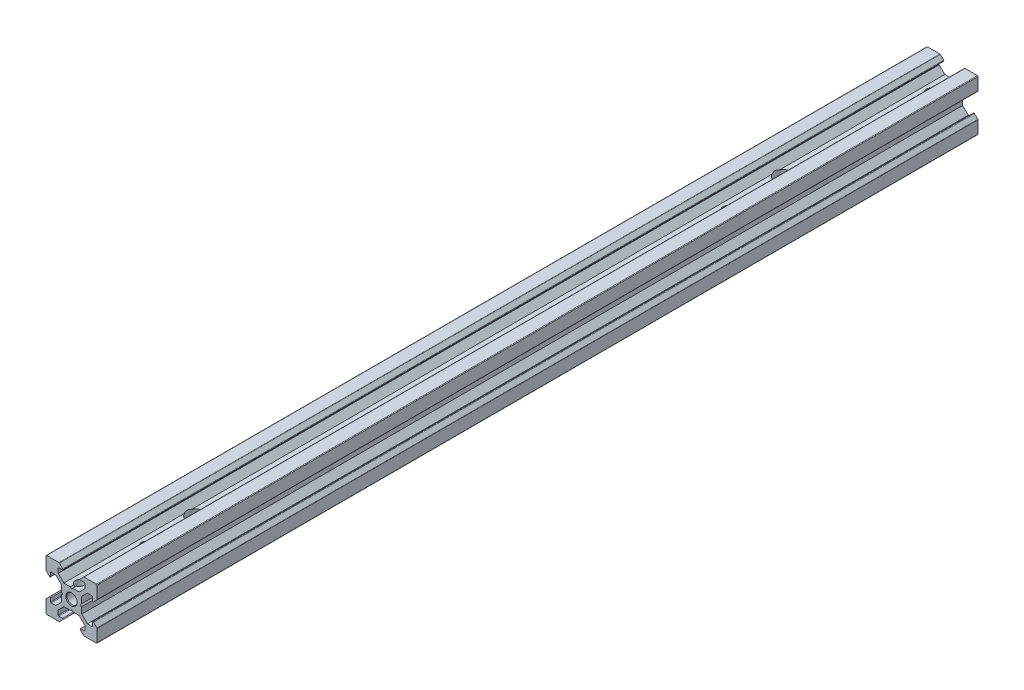
from build123d import *

# Parameters (mm, degrees)
SALIENTE_EXTRUIR1_DEPTH                              = 172.5
SALIENTE_EXTRUIR1_DEPTH_BACK                         = 172.5
CROQUIS7_R                                           = 2
CORTAR_EXTRUIR1_DEPTH                                = 346.290048435
CHAFL_N1_SIZE                                        = 0.25
DI_METRO_DE_TALADRO_3_3_3_3_1_REACH                  = 175.944
DI_METRO_DE_TALADRO_3_3_3_3_1_BORE_R                 = 1.65
REFRENTADO_PARA_TORNILLO_CON_CABEZA_PLAN_D           = 6.6
REFRENTADO_PARA_TORNILLO_CON_CABEZA_PLAN_CBORE_D     = 11
REFRENTADO_PARA_TORNILLO_CON_CABEZA_PLAN_CBORE_DEPTH = 3.9


with BuildPart() as part:
    # Croquis1 → Saliente-Extruir1 (new, two sides: drawn at the far end of the back side and taken through both)
    with BuildSketch(Plane.XY.offset(-SALIENTE_EXTRUIR1_DEPTH_BACK)):
        with BuildLine():
            Line((-3.987829457, 0.499361283), (-3.487829457, -0.000638717))
            Line((-3.487829457, -0.000638717), (-3.987559517, -0.500368777))
            Line((-3.987559517, -0.500368777), (-3.987559517, -3.008827233))
            Line((-3.987559517, -3.008827233), (-6.187829457, -5.209097173))
            Line((-6.187829457, -5.209097173), (-7.930785329, -5.209097173))
            ThreePointArc((-7.930785329, -5.209097173), (-8.107562024, -5.135873868), (-8.180785329, -4.959097173))
            Line((-8.180785329, -4.959097173), (-8.180785329, -3.614398294))
            ThreePointArc((-8.180785329, -3.614398294), (-8.335114237, -3.383428508), (-8.607561665, -3.43762124))
            Line((-8.607561665, -3.43762124), (-9.913674799, -4.743729068))
            ThreePointArc((-9.913674799, -4.743729068), (-9.967868248, -4.824835029), (-9.986898462, -4.920506122))
            Line((-9.986898462, -4.920506122), (-9.986898462, -9.749046667))
            ThreePointArc((-9.986898462, -9.749046667), (-9.913675158, -9.925823362), (-9.736898462, -9.999046667))
            Line((-9.736898462, -9.999046667), (-4.889520858, -9.999046667))
            ThreePointArc((-4.889520858, -9.999046667), (-4.79385, -9.98001655), (-4.712744163, -9.925823362))
            Line((-4.712744163, -9.925823362), (-3.412744163, -8.625823362))
            ThreePointArc((-3.412744163, -8.625823362), (-3.358550975, -8.353375809), (-3.589520858, -8.199046667))
            Line((-3.589520858, -8.199046667), (-4.947879963, -8.199046667))
            ThreePointArc((-4.947879963, -8.199046667), (-5.124656659, -8.125823362), (-5.197879963, -7.949046667))
            Line((-5.197879963, -7.949046667), (-5.197879963, -6.302600057))
            ThreePointArc((-5.197879963, -6.302600057), (-5.178849847, -6.206929199), (-5.124656659, -6.125823362))
            Line((-5.124656659, -6.125823362), (-2.998810958, -3.999977662))
            Line((-2.998810958, -3.999977662), (-0.486898462, -3.999977662))
            Line((-0.486898462, -3.999977662), (0.013101538, -3.499977662))
            Line((0.013101538, -3.499977662), (0.512831598, -3.999707722))
            Line((0.512831598, -3.999707722), (3.021290054, -3.999707722))
            Line((3.021290054, -3.999707722), (5.221559994, -6.199977662))
            Line((5.221559994, -6.199977662), (5.221559994, -7.942933534))
            ThreePointArc((5.221559994, -7.942933534), (5.148336689, -8.119710229), (4.971559994, -8.192933534))
            Line((4.971559994, -8.192933534), (3.626861115, -8.192933534))
            ThreePointArc((3.626861115, -8.192933534), (3.395891329, -8.347262441), (3.450084061, -8.61970987))
            Line((3.450084061, -8.61970987), (4.756191889, -9.925823003))
            ThreePointArc((4.756191889, -9.925823003), (4.83729785, -9.980016453), (4.932968943, -9.999046667))
            Line((4.932968943, -9.999046667), (9.761509488, -9.999046667))
            ThreePointArc((9.761509488, -9.999046667), (9.938286183, -9.925823362), (10.011509488, -9.749046667))
            Line((10.011509488, -9.749046667), (10.011509488, -4.901669063))
            ThreePointArc((10.011509488, -4.901669063), (9.992479371, -4.805998205), (9.938286183, -4.724892367))
            Line((9.938286183, -4.724892367), (8.638286183, -3.424892367))
            ThreePointArc((8.638286183, -3.424892367), (8.36583863, -3.370699179), (8.211509488, -3.601669063))
            Line((8.211509488, -3.601669063), (8.211509488, -4.960028168))
            ThreePointArc((8.211509488, -4.960028168), (8.138286183, -5.136804863), (7.961509488, -5.210028168))
            Line((7.961509488, -5.210028168), (6.211509488, -5.210028168))
            Line((6.211509488, -5.210028168), (4.012440483, -3.010959163))
            Line((4.012440483, -3.010959163), (4.012440483, -0.499046667))
            Line((4.012440483, -0.499046667), (3.512440483, 0.000953333))
            Line((3.512440483, 0.000953333), (4.012170543, 0.500683393))
            Line((4.012170543, 0.500683393), (4.012170543, 3.00914185))
            Line((4.012170543, 3.00914185), (6.212440483, 5.20941179))
            Line((6.212440483, 5.20941179), (7.955396355, 5.20941179))
            ThreePointArc((7.955396355, 5.20941179), (8.13217305, 5.136188485), (8.205396355, 4.95941179))
            Line((8.205396355, 4.95941179), (8.205396355, 3.61471291))
            ThreePointArc((8.205396355, 3.61471291), (8.359725262, 3.383743124), (8.632172691, 3.437935856))
            Line((8.632172691, 3.437935856), (9.938285824, 4.744043684))
            ThreePointArc((9.938285824, 4.744043684), (9.992479274, 4.825149646), (10.011509488, 4.920820738))
            Line((10.011509488, 4.920820738), (10.011509488, 9.749361283))
            ThreePointArc((10.011509488, 9.749361283), (9.938286183, 9.926137979), (9.761509488, 9.999361283))
            Line((9.761509488, 9.999361283), (4.914131884, 9.999361283))
            ThreePointArc((4.914131884, 9.999361283), (4.818461026, 9.980331166), (4.737355188, 9.926137979))
            Line((4.737355188, 9.926137979), (3.437355188, 8.626137979))
            ThreePointArc((3.437355188, 8.626137979), (3.383162001, 8.353690425), (3.614131884, 8.199361283))
            Line((3.614131884, 8.199361283), (4.972490989, 8.199361283))
            ThreePointArc((4.972490989, 8.199361283), (5.149267684, 8.126137979), (5.222490989, 7.949361283))
            Line((5.222490989, 7.949361283), (5.222490989, 6.199361283))
            Line((5.222490989, 6.199361283), (3.023421984, 4.000292278))
            Line((3.023421984, 4.000292278), (0.511509488, 4.000292278))
            Line((0.511509488, 4.000292278), (0.011509488, 3.500292278))
            Line((0.011509488, 3.500292278), (-0.488220572, 4.000022338))
            Line((-0.488220572, 4.000022338), (-2.996679029, 4.000022338))
            Line((-2.996679029, 4.000022338), (-5.196948969, 6.200292278))
            Line((-5.196948969, 6.200292278), (-5.196948969, 7.94324815))
            ThreePointArc((-5.196948969, 7.94324815), (-5.123725664, 8.120024846), (-4.946948969, 8.19324815))
            Line((-4.946948969, 8.19324815), (-3.602250089, 8.19324815))
            ThreePointArc((-3.602250089, 8.19324815), (-3.371280303, 8.347577058), (-3.425473035, 8.620024487))
            Line((-3.425473035, 8.620024487), (-4.731580863, 9.92613762))
            ThreePointArc((-4.731580863, 9.92613762), (-4.812686825, 9.980331069), (-4.908357917, 9.999361283))
            Line((-4.908357917, 9.999361283), (-9.736898462, 9.999361283))
            ThreePointArc((-9.736898462, 9.999361283), (-9.913675158, 9.926137979), (-9.986898462, 9.749361283))
            Line((-9.986898462, 9.749361283), (-9.986898462, 4.901983679))
            ThreePointArc((-9.986898462, 4.901983679), (-9.967868345, 4.806312821), (-9.913675158, 4.725206984))
            Line((-9.913675158, 4.725206984), (-8.613675158, 3.425206984))
            ThreePointArc((-8.613675158, 3.425206984), (-8.341227604, 3.371013796), (-8.186898462, 3.601983679))
            Line((-8.186898462, 3.601983679), (-8.186898462, 4.960342784))
            ThreePointArc((-8.186898462, 4.960342784), (-8.113675158, 5.13711948), (-7.936898462, 5.210342784))
            Line((-7.936898462, 5.210342784), (-6.186898462, 5.210342784))
            Line((-6.186898462, 5.210342784), (-3.987829457, 3.011273779))
            Line((-3.987829457, 3.011273779), (-3.987829457, 0.499361283))
        make_face()
    extrude(amount=SALIENTE_EXTRUIR1_DEPTH + SALIENTE_EXTRUIR1_DEPTH_BACK)

    # Croquis7 → Cortar-Extruir1 (cut, through all)
    with BuildSketch(Plane.XY.offset(172.5)):
        Circle(CROQUIS7_R)
    extrude(amount=-CORTAR_EXTRUIR1_DEPTH, mode=Mode.SUBTRACT)

    # Chaflán1
    chafl_n1_edges = [part.edges().sort_by_distance(p)[0] for p in [
        (-2, 0, -172.5),
        (-2, 0, 172.5),
    ]]
    chamfer(chafl_n1_edges, length=CHAFL_N1_SIZE)

    # Diámetro de taladro Ø3.3 (3.3)1 bore → Diámetro de taladro Ø3.3 (3.3)1 (cut, up to next)
    with BuildSketch(Plane(origin=(0, 9.999361283, 0), x_dir=(1, 0, 0), z_dir=(0, 1, 0)), mode=Mode.PRIVATE) as di_metro_de_taladro_3_3_3_3_1_sk1:
        with Locations((0.011509488, -143.5)):
            Circle(DI_METRO_DE_TALADRO_3_3_3_3_1_BORE_R)
    di_metro_de_taladro_3_3_3_3_1_tool1 = extrude(di_metro_de_taladro_3_3_3_3_1_sk1.sketch, amount=-DI_METRO_DE_TALADRO_3_3_3_3_1_REACH, mode=Mode.PRIVATE) & part.part
    # Diámetro de taladro Ø3.3 (3.3)1 bore → Diámetro de taladro Ø3.3 (3.3)1 (cut, up to next)
    with BuildSketch(Plane(origin=(0, 9.999361283, 0), x_dir=(1, 0, 0), z_dir=(0, 1, 0)), mode=Mode.PRIVATE) as di_metro_de_taladro_3_3_3_3_1_sk2:
        with Locations((0.011509488, -169.5)):
            Circle(DI_METRO_DE_TALADRO_3_3_3_3_1_BORE_R)
    di_metro_de_taladro_3_3_3_3_1_tool2 = extrude(di_metro_de_taladro_3_3_3_3_1_sk2.sketch, amount=-DI_METRO_DE_TALADRO_3_3_3_3_1_REACH, mode=Mode.PRIVATE) & part.part
    # Diámetro de taladro Ø3.3 (3.3)1 bore → Diámetro de taladro Ø3.3 (3.3)1 (cut, up to next)
    with BuildSketch(Plane(origin=(0, 9.999361283, 0), x_dir=(1, 0, 0), z_dir=(0, 1, 0)), mode=Mode.PRIVATE) as di_metro_de_taladro_3_3_3_3_1_sk3:
        with Locations((0.011509488, 84.2)):
            Circle(DI_METRO_DE_TALADRO_3_3_3_3_1_BORE_R)
    di_metro_de_taladro_3_3_3_3_1_tool3 = extrude(di_metro_de_taladro_3_3_3_3_1_sk3.sketch, amount=-DI_METRO_DE_TALADRO_3_3_3_3_1_REACH, mode=Mode.PRIVATE) & part.part
    # Diámetro de taladro Ø3.3 (3.3)1 bore → Diámetro de taladro Ø3.3 (3.3)1 (cut, up to next)
    with BuildSketch(Plane(origin=(0, 9.999361283, 0), x_dir=(1, 0, 0), z_dir=(0, 1, 0)), mode=Mode.PRIVATE) as di_metro_de_taladro_3_3_3_3_1_sk4:
        with Locations((0.011509488, 163.9)):
            Circle(DI_METRO_DE_TALADRO_3_3_3_3_1_BORE_R)
    di_metro_de_taladro_3_3_3_3_1_tool4 = extrude(di_metro_de_taladro_3_3_3_3_1_sk4.sketch, amount=-DI_METRO_DE_TALADRO_3_3_3_3_1_REACH, mode=Mode.PRIVATE) & part.part
    add(di_metro_de_taladro_3_3_3_3_1_tool1.solids().sort_by_distance((0.011509, 9.999361, 143.5))[0], mode=Mode.SUBTRACT)
    add(di_metro_de_taladro_3_3_3_3_1_tool2.solids().sort_by_distance((0.011509, 9.999361, 169.5))[0], mode=Mode.SUBTRACT)
    add(di_metro_de_taladro_3_3_3_3_1_tool3.solids().sort_by_distance((0.011509, 9.999361, -84.2))[0], mode=Mode.SUBTRACT)
    add(di_metro_de_taladro_3_3_3_3_1_tool4.solids().sort_by_distance((0.011509, 9.999361, -163.9))[0], mode=Mode.SUBTRACT)

    # Refrentado para tornillo con cabeza plana de M61 (through all)
    with Locations(Plane(origin=(0, -9.999046667, 0), x_dir=(-1, 0, 0), z_dir=(0, -1, 0))):
        with Locations((0, -123.9), (0, 106.3)):
            CounterBoreHole(REFRENTADO_PARA_TORNILLO_CON_CABEZA_PLAN_D / 2, REFRENTADO_PARA_TORNILLO_CON_CABEZA_PLAN_CBORE_D / 2, REFRENTADO_PARA_TORNILLO_CON_CABEZA_PLAN_CBORE_DEPTH)


solid = part.part
